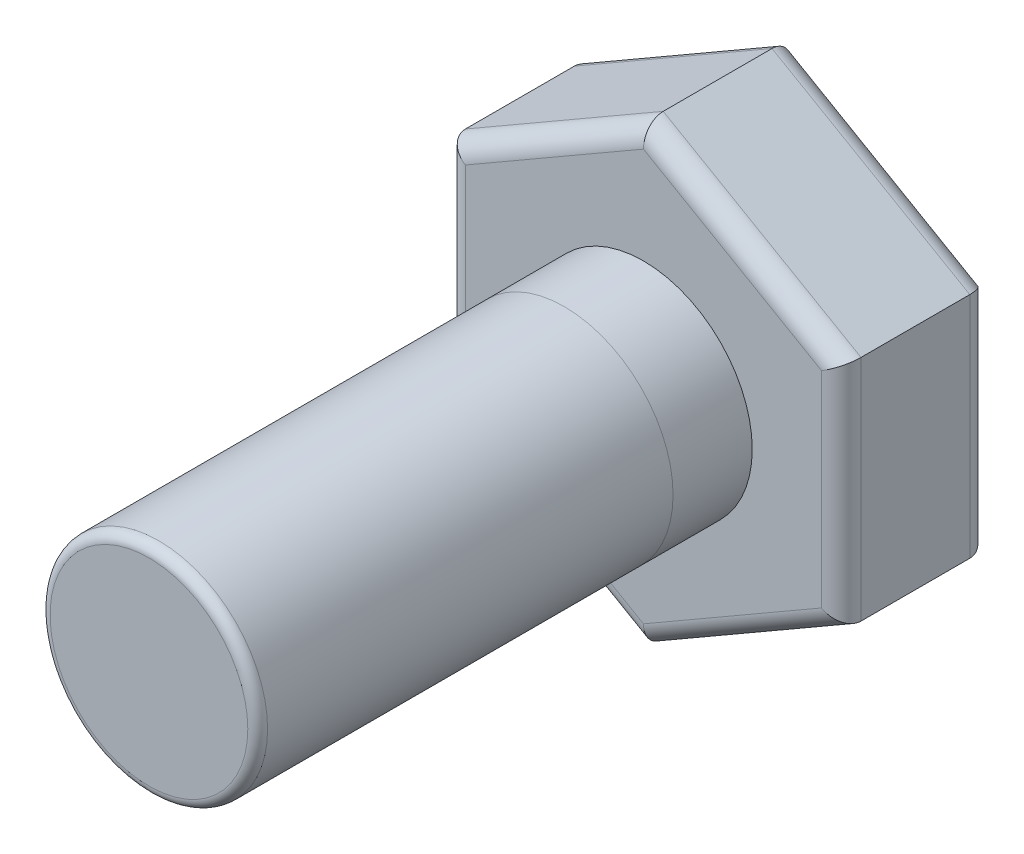
from build123d import *

# Parameters (mm, degrees)
EXTRUDE_440_DEPTH = 15
SKETCH_2_R        = 11
EXTRUDE_1_DEPTH   = 8
FILLET_3_R        = 2
SKETCH_3_R        = 10.995
EXTRUDE_1_2_DEPTH = 42
FILLET_4_R        = 1


with BuildPart() as part:
    # 草图1 → Extrude 440 (new body)
    with BuildSketch(Plane.XY):
        Polygon((20, 11.547005384), (0, 23.094010768), (-20, 11.547005384), (-20, -11.547005384), (0, -23.094010768), (20, -11.547005384), align=None)
    extrude(amount=EXTRUDE_440_DEPTH)

    # 草图2 → Extrude 1 (add)
    with BuildSketch(Plane.XY.offset(15)):
        Circle(SKETCH_2_R)
    extrude(amount=EXTRUDE_1_DEPTH)

    # 圆角3
    fillet_3_edges = [part.edges().sort_by_distance(p)[0] for p in [
        (-10, 17.320508076, 15),
        (-20, 0, 15),
        (-10, -17.320508076, 15),
        (10, -17.320508076, 15),
        (20, 0, 15),
        (10, -17.320508076, 0),
        (-10, -17.320508076, 0),
        (-20, 0, 0),
        (10, 17.320508076, 15),
        (-10, 17.320508076, 0),
        (10, 17.320508076, 0),
        (20, 0, 0),
    ]]
    fillet(fillet_3_edges, radius=FILLET_3_R)

    # 草图3 → Extrude 1 2 (add)
    with BuildSketch(Plane.XY.offset(23)):
        Circle(SKETCH_3_R)
    extrude(amount=EXTRUDE_1_2_DEPTH)

    # 圆角4
    fillet_4_edges = [part.edges().sort_by_distance(p)[0] for p in [
        (-10.995, 0, 65),
    ]]
    fillet(fillet_4_edges, radius=FILLET_4_R)


solid = part.part
